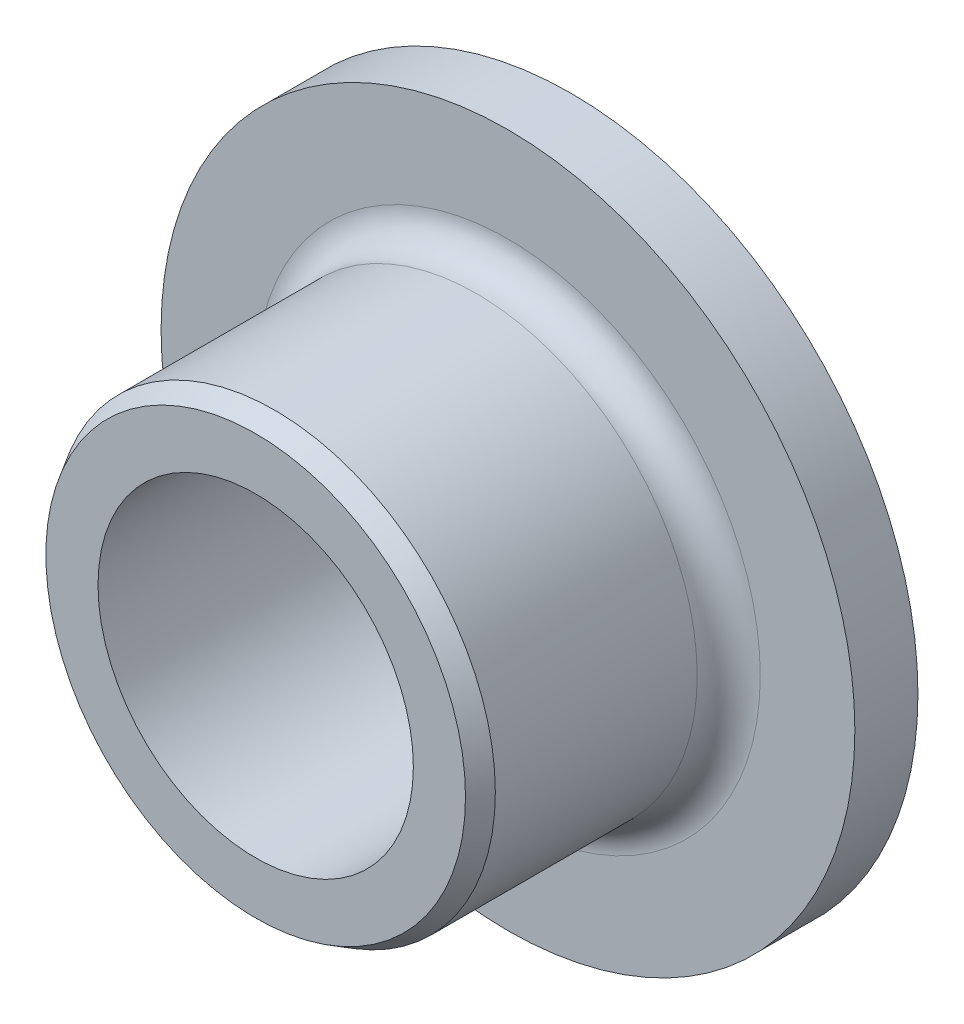
from build123d import *


with BuildPart() as part:
    # Sketch1 → Revolve1 (revolve)
    with BuildSketch(Plane(origin=(0, 0, 0), x_dir=(1, 0, 0), z_dir=(0, 1, 0))):
        with BuildLine():
            Line((3.5, -4.7), (3.5, -1.5))
            ThreePointArc((3.5, -1.5), (3.646446609, -1.146446609), (4, -1))
            Line((4, -1), (5.5, -1))
            Line((5.5, -1), (5.5, 0))
            Line((5.5, 0), (2.5, 0))
            Line((2.5, 0), (2.5, -5))
            Line((2.5, -5), (3.326794919, -5))
            Line((3.326794919, -5), (3.5, -4.7))
        make_face()
    revolve(axis=Axis((0, 0, 0), (0, 0, 1)))


solid = part.part
